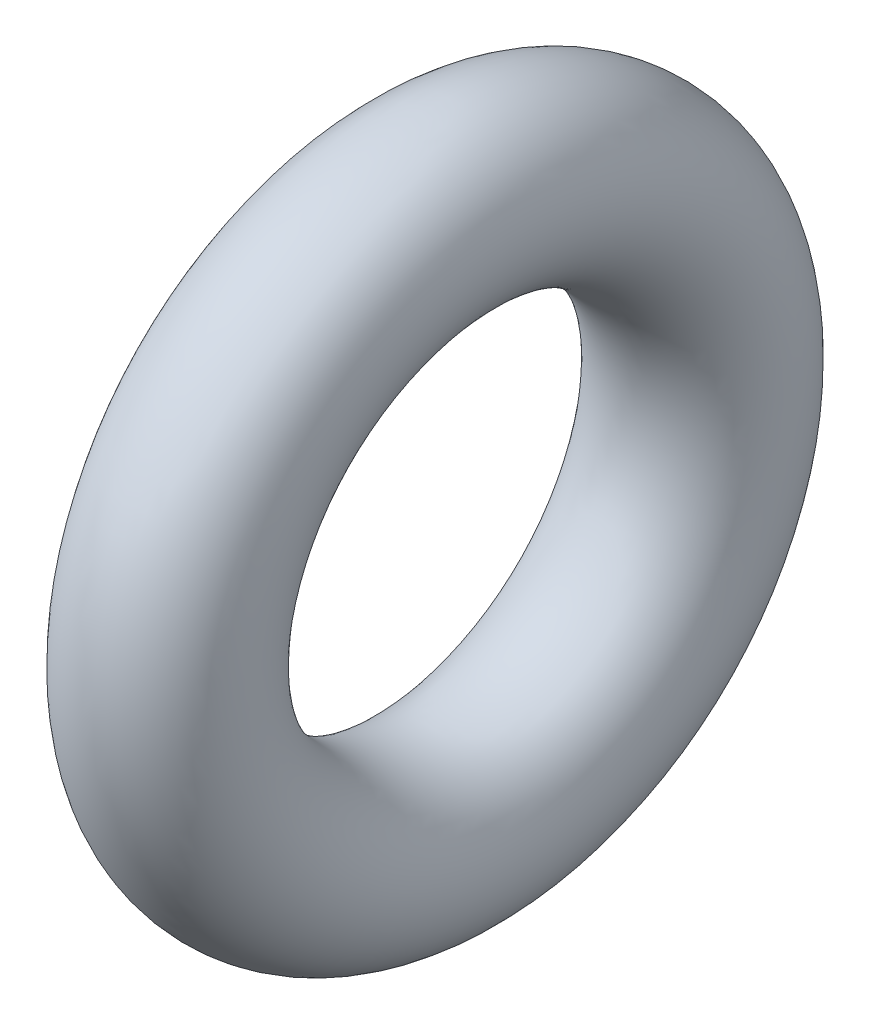
from build123d import *

# Parameters (mm, degrees)
SKETCH1_R = 7


with BuildPart() as part:
    # Sketch1 → Revolve1 (revolve)
    with BuildSketch(Plane.XY, mode=Mode.PRIVATE) as revolve1_sk:
        with Locations((0, 21.9)):
            Circle(SKETCH1_R)
    revolve(revolve1_sk.sketch.rotate(Axis((-9.617945587, 0, 0), (1, 0, 0)), 90), axis=Axis((-9.617945587, 0, 0), (1, 0, 0)))


solid = part.part
